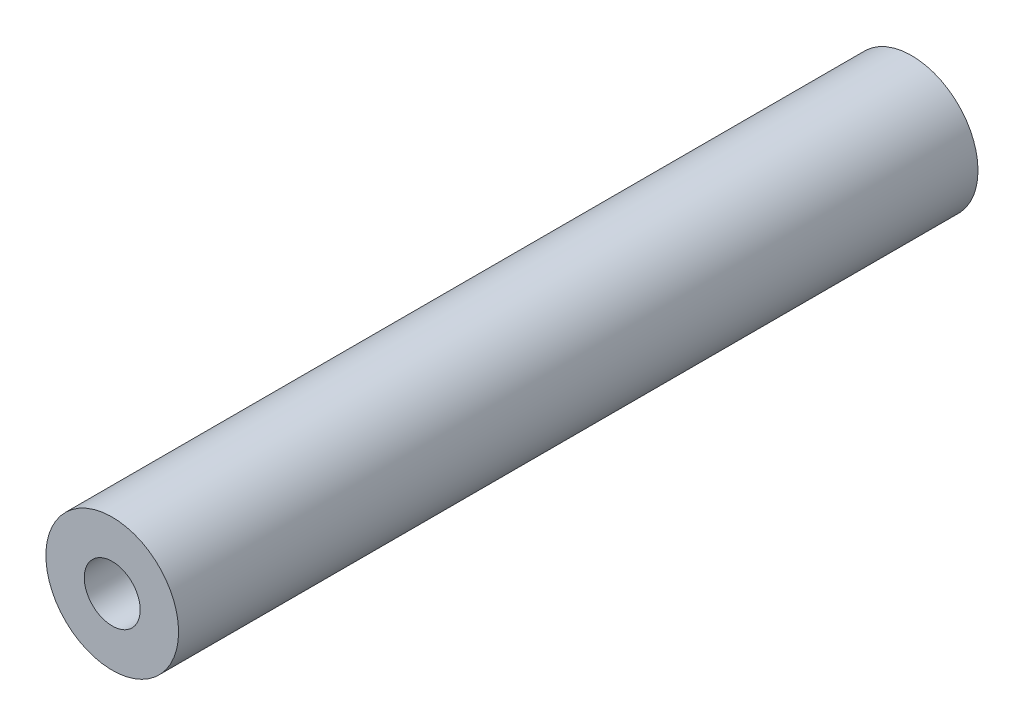
from build123d import *

# Parameters (mm, degrees)
EXTRUDE_1_DEPTH      = 12.5
EXTRUDE_1_DEPTH_BACK = 12.5
SKETCH_1_R           = 2.075
SKETCH_1_R_2         = 0.875
EXTRUDE_2_DEPTH      = 2
EXTRUDE_2_DEPTH_BACK = 2
SKETCH_2_R           = 0.875
SKETCH_2_R_2         = 0.4375


with BuildPart() as part:
    # Эскиз1 → Бобышка-Вытянуть1 (new, two sides: drawn at the far end of the back side and taken through both)
    with BuildSketch(Plane.XY.offset(-EXTRUDE_1_DEPTH_BACK)):
        Circle(SKETCH_1_R)
        Circle(SKETCH_1_R_2, mode=Mode.SUBTRACT)
    extrude(amount=EXTRUDE_1_DEPTH + EXTRUDE_1_DEPTH_BACK)


with BuildPart() as body_2:
    # Эскиз2 → Бобышка-Вытянуть2 (new, two sides: drawn at the far end of the back side and taken through both)
    with BuildSketch(Plane.XY.offset(-EXTRUDE_2_DEPTH_BACK)):
        Circle(SKETCH_2_R)
        Circle(SKETCH_2_R_2, mode=Mode.SUBTRACT)
    extrude(amount=EXTRUDE_2_DEPTH + EXTRUDE_2_DEPTH_BACK)


solid = Compound([part.part, body_2.part])
